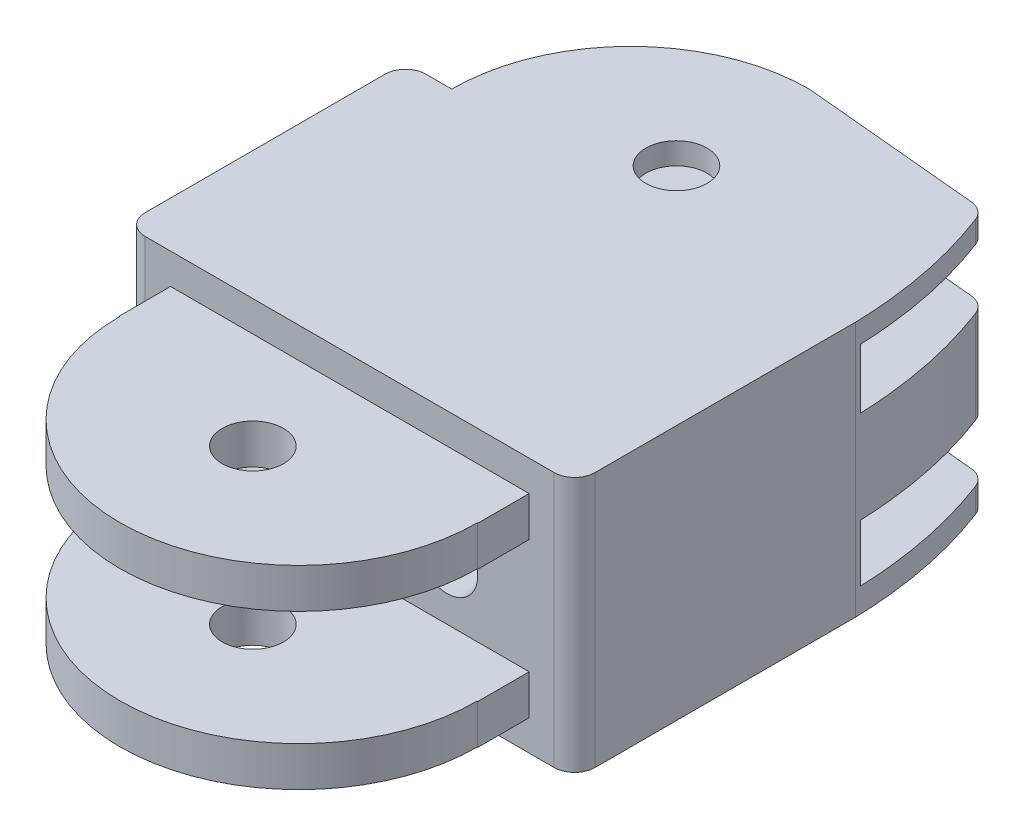
from build123d import *

# Parameters (mm, degrees)
SKETCH2_W             = 17.554431489
SKETCH2_H             = 1.95
BOSS_EXTRUDE1_DEPTH   = 8.75
BOSS_EXTRUDE1_2_DEPTH = 8.75
CUT_EXTRUDE1_DEPTH    = 26.518349076
SKETCH4_W             = 22.027215745
SKETCH4_H             = 12.505427167
BOSS_EXTRUDE2_DEPTH   = 25
SKETCH5_R             = 1.5
CUT_EXTRUDE2_DEPTH    = 12
SKETCH6_W             = 22.027215745
SKETCH6_H             = 12.505427167
SKETCH6_W_2           = 17.554431489
SKETCH6_H_2           = 1.95
CUT_EXTRUDE3_DEPTH    = 2.5
SKETCH7_R             = 1.5
CUT_EXTRUDE4_DEPTH    = 13
SKETCH8_R             = 1.5
CUT_EXTRUDE5_DEPTH    = 28
FILLET3_R             = 1
SKETCH9_W             = 22.195824916
SKETCH9_H             = 2.918094069
SKETCH9_H_2           = 2.791777891
CUT_EXTRUDE6_DEPTH    = 16
SKETCH10_W            = 18.125143393
SKETCH10_H            = 2.791777891
SKETCH10_H_2          = 2.918094069
CUT_EXTRUDE7_DEPTH    = 5


with BuildPart() as part:
    # Sketch2 → Boss-Extrude1 (new body)
    with BuildSketch(Plane.XY):
        with Locations((-13.228930986, -27.845183414)):
            Rectangle(SKETCH2_W, SKETCH2_H)
    extrude(amount=BOSS_EXTRUDE1_DEPTH)


with BuildPart() as body_2:
    # Sketch2 → Boss-Extrude1 2 (new body)
    with BuildSketch(Plane.XY):
        with Locations((-13.228930986, -20.289756247)):
            Rectangle(SKETCH2_W, SKETCH2_H)
    extrude(amount=BOSS_EXTRUDE1_2_DEPTH)


with BuildPart() as cut_extrude1_tool:
    # Sketch3 → Cut-Extrude1 (new, through all)
    with BuildSketch(Plane(origin=(0, -19.314756247, 0), x_dir=(1, 0, 0), z_dir=(0, 1, 0))):
        with BuildLine():
            ThreePointArc((-13.228930986, -8.75), (-7.041746651, -6.187184335), (-4.478930986, 0))
            add(Edge.make_bspline(
                [(-4.478930986, 0), (1.138349918, -4.151657709), (-4.451715242, -8.75)],
                knots=[0, 0, 0, 1, 1, 1], degree=2))
            add(Edge.make_bspline(
                [(-22.006146731, -8.75), (-13.228930986, -12.473510392), (-4.451715242, -8.75)],
                knots=[0, 0, 0, 1, 1, 1], degree=2))
            add(Edge.make_bspline(
                [(-21.978930986, 0), (-25.926969228, -4.242865138), (-22.006146731, -8.75)],
                knots=[0, 0, 0, 1, 1, 1], degree=2))
            ThreePointArc((-21.978930986, 0), (-19.416115322, -6.187184335), (-13.228930986, -8.75))
        make_face()
    extrude(amount=-CUT_EXTRUDE1_DEPTH)


with BuildPart() as part_1:
    add(part.part)

    # Cut-Extrude1: cut by cut_extrude1_tool
    add(cut_extrude1_tool.part, mode=Mode.SUBTRACT)



with BuildPart() as body_2_1:
    add(body_2.part)

    # Cut-Extrude1: cut by cut_extrude1_tool
    add(cut_extrude1_tool.part, mode=Mode.SUBTRACT)


with BuildPart() as part_2:
    add(part_1.part)

    add(body_2_1.part)  # Boss-Extrude2 merges body 2
    # Sketch4 → Boss-Extrude2 (add)
    with BuildSketch(Plane(origin=(0, 0, 0), x_dir=(-1, 0, 0), z_dir=(0, 0, -1))):
        with Locations((13.242538859, -24.067469831)):
            Rectangle(SKETCH4_W, SKETCH4_H)
    extrude(amount=BOSS_EXTRUDE2_DEPTH)

    # Sketch5 → Cut-Extrude2 (cut)
    with BuildSketch(Plane(origin=(0, -19.314756247, 0), x_dir=(1, 0, 0), z_dir=(0, 1, 0))):
        with Locations(Location((-13.228930986, -2.25, 0), (0, 0, 270))):
            Circle(SKETCH5_R)
    extrude(amount=-CUT_EXTRUDE2_DEPTH, mode=Mode.SUBTRACT)

    # Sketch6 → Cut-Extrude3 (cut)
    with BuildSketch(Plane.XY):
        with Locations((-13.242538859, -24.067469831)):
            Rectangle(SKETCH6_W, SKETCH6_H)
        with Locations((-13.228930986, -27.845183414)):
            Rectangle(SKETCH6_W_2, SKETCH6_H_2, mode=Mode.SUBTRACT)
        with Locations((-13.228930986, -20.289756247)):
            Rectangle(SKETCH6_W_2, SKETCH6_H_2, mode=Mode.SUBTRACT)
    extrude(amount=-CUT_EXTRUDE3_DEPTH, mode=Mode.SUBTRACT)

    # Sketch7 → Cut-Extrude4 (cut)
    with BuildSketch(Plane(origin=(0, -17.814756247, 0), x_dir=(1, 0, 0), z_dir=(0, 1, 0))):
        with Locations(Location((-13.242538859, 18.5, 0), (0, 0, 270))):
            Circle(SKETCH7_R)
        with BuildLine():
            Line((-21.992538859, 16.25), (-24.256146731, 16.25))
            add(Edge.make_bspline(
                [(-24.256146731, 16.25), (-34.36884236, 22.178246018), (-14.712267615, 52.032901089), (16.629341759, 22.46378621), (-2.228930986, 16.25)],
                knots=[0, 0, 0, 0, 0.431250879, 1, 1, 1, 1], degree=3))
            add(Edge.make_bspline(
                [(-3.881799271, 24.128638582), (-2.328777172, 20.372571126), (-2.228930986, 16.25)],
                knots=[0, 0, 0, 1, 1, 1], degree=2))
            Line((-3.881799271, 24.128638582), (-13.242538859, 25))
            ThreePointArc((-13.242538859, 25), (-19.429723194, 22.437184335), (-21.992538859, 16.25))
        make_face()
    extrude(amount=-CUT_EXTRUDE4_DEPTH, mode=Mode.SUBTRACT)

    # Sketch8 → Cut-Extrude5 (cut)
    with BuildSketch(Plane.XY.offset(-2.5)):
        with Locations((-18.011106811, -24.06746983)):
            Circle(SKETCH8_R)
        with Locations((-8.473970906, -24.06746983)):
            Circle(SKETCH8_R)
    extrude(amount=-CUT_EXTRUDE5_DEPTH, mode=Mode.SUBTRACT)

    # Fillet3
    fillet3_edges = [part_2.edges().sort_by_distance(p)[0] for p in [
        (-24.256146731, -24.06746983, -2.5),
        (-24.256146731, -24.06746983, -16.25),
        (-2.228930986, -24.06746983, -2.5),
        (-3.881799271, -24.06746983, -24.128638582),
    ]]
    fillet(fillet3_edges, radius=FILLET3_R)

    # Sketch9 → Cut-Extrude6 (cut)
    with BuildSketch(Plane.XY.offset(-32.5)):
        with Locations((-13.24253886, -20.339836801)):
            Rectangle(SKETCH9_W, SKETCH9_H)
        with Locations((-13.24253886, -27.73194478)):
            Rectangle(SKETCH9_W, SKETCH9_H_2)
    extrude(amount=CUT_EXTRUDE6_DEPTH, mode=Mode.SUBTRACT)

    # Sketch10 → Cut-Extrude7 (cut)
    with BuildSketch(Plane(origin=(0, 0, -16.5), x_dir=(-1, 0, 0), z_dir=(0, 0, -1))):
        with Locations((12.926395005, -27.73194478)):
            Rectangle(SKETCH10_W, SKETCH10_H)
        with Locations((12.926395005, -20.339836801)):
            Rectangle(SKETCH10_W, SKETCH10_H_2)
    extrude(amount=-CUT_EXTRUDE7_DEPTH, mode=Mode.SUBTRACT)


solid = part_2.part
